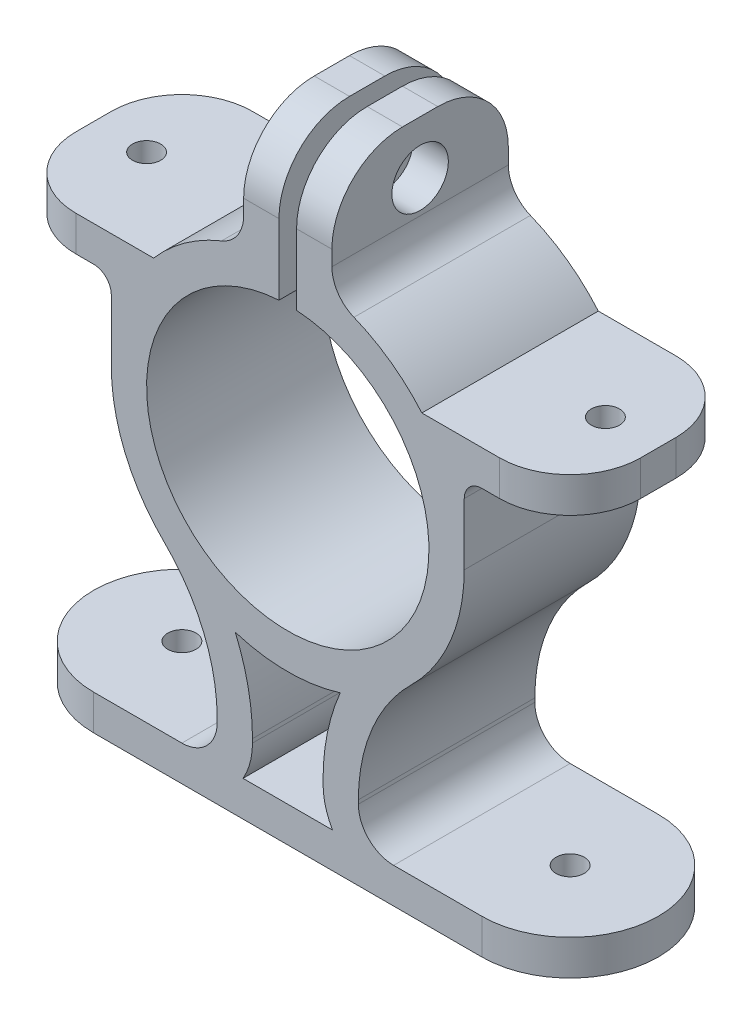
from build123d import *

# Parameters (mm, degrees)
BOSS_EXTRUDE1_DEPTH = 10
SKETCH3_R           = 0.8
CUT_EXTRUDE1_DEPTH  = 2
SKETCH4_R           = 0.8
CUT_EXTRUDE2_DEPTH  = 2
SKETCH5_R           = 0.8
CUT_EXTRUDE3_DEPTH  = 2
SKETCH6_R           = 0.8
CUT_EXTRUDE4_DEPTH  = 3
SKETCH7_R           = 1.6
CUT_EXTRUDE5_DEPTH  = 3
CUT_EXTRUDE6_DEPTH  = 10


with BuildPart() as part:
    # Sketch1 → Boss-Extrude1 (new body)
    with BuildSketch(Plane.XY):
        with BuildLine():
            Line((16.803004448, 0), (48.803096805, 0))
            Line((48.803096805, 0), (48.803096805, 2))
            Line((48.803096805, 2), (38.803096805, 2))
            ThreePointArc((38.803096805, 2), (37.388883243, 2.585786438), (36.803096805, 4))
            Line((36.803096805, 4), (36.803096805, 4.217123744))
            ThreePointArc((36.803096805, 4.217123744), (37.58355047, 8.090102619), (39.803089878, 11.358545383))
            ThreePointArc((39.803089878, 11.358545383), (42.022639537, 14.62700324), (42.803096805, 18.5))
            Line((42.803096805, 18.5), (42.803096805, 22))
            ThreePointArc((42.803096805, 22), (43.095990024, 22.707106781), (43.803096805, 23))
            Line((43.803096805, 23), (48.803096805, 23))
            Line((48.803096805, 23), (48.803096805, 25))
            Line((48.803096805, 25), (44.105786895, 25))
            Line((44.105786895, 25), (40.40245347, 25))
            ThreePointArc((40.40245347, 25), (38.644426823, 26.616603213), (36.553207437, 27.770234489))
            ThreePointArc((36.553207437, 27.770234489), (35.644914528, 28.506251313), (35.303235335, 29.624272825))
            Line((35.303235335, 29.624272825), (35.303235335, 34.487492178))
            Line((35.303235335, 34.487492178), (33.303050626, 34.487492178))
            Line((33.303050626, 34.487492178), (33.303050626, 26.484348185))
            ThreePointArc((33.303050626, 26.484348185), (32.803050626, 10.500011503), (32.303050626, 26.484348185))
            Line((32.303050626, 26.484348185), (32.303050626, 34.487492178))
            Line((32.303050626, 34.487492178), (30.303050626, 34.487492178))
            Line((30.303050626, 34.487492178), (30.303050626, 29.624347545))
            ThreePointArc((30.303050626, 29.624347545), (29.961362151, 28.506312265), (29.05304774, 27.770296755))
            ThreePointArc((29.05304774, 27.770296755), (26.961741815, 26.616651708), (25.203647783, 25))
            Line((25.203647783, 25), (21.500314358, 25))
            Line((21.500314358, 25), (16.803004448, 25))
            Line((16.803004448, 25), (16.803004448, 23))
            Line((16.803004448, 23), (21.803004448, 23))
            ThreePointArc((21.803004448, 23), (22.510111229, 22.707106781), (22.803004448, 22))
            Line((22.803004448, 22), (22.803004448, 18.5))
            ThreePointArc((22.803004448, 18.5), (23.583461716, 14.62700324), (25.803011375, 11.358545383))
            ThreePointArc((25.803011375, 11.358545383), (28.022550783, 8.090102619), (28.803004448, 4.217123744))
            Line((28.803004448, 4.217123744), (28.803004448, 4))
            ThreePointArc((28.803004448, 4), (28.21721801, 2.585786438), (26.803004448, 2))
            Line((26.803004448, 2), (16.803004448, 2))
            Line((16.803004448, 2), (16.803004448, 0))
        make_face()
        with BuildLine():
            Line((34.803096805, 4), (34.803096805, 4.217123744))
            ThreePointArc((34.803096805, 4.217123744), (35.049071096, 6.634328662), (35.776910074, 8.952438536))
            ThreePointArc((35.776910074, 8.952438536), (32.803050626, 8.500011503), (29.829191179, 8.952438536))
            ThreePointArc((29.829191179, 8.952438536), (30.557030157, 6.634328662), (30.803004448, 4.217123744))
            Line((30.803004448, 4.217123744), (30.803004448, 4))
            ThreePointArc((30.803004448, 4), (30.666707753, 2.96472382), (30.267106063, 2))
            Line((30.267106063, 2), (35.33899519, 2))
            ThreePointArc((35.33899519, 2), (34.9393935, 2.96472382), (34.803096805, 4))
        make_face(mode=Mode.SUBTRACT)
    extrude(amount=BOSS_EXTRUDE1_DEPTH)

    # Sketch3 → Cut-Extrude1 (cut)
    with BuildSketch(Plane(origin=(0, 2, 0), x_dir=(1, 0, 0), z_dir=(0, 1, 0))):
        with BuildLine():
            ThreePointArc((48.803096805, -5), (47.338630711, -8.535533906), (43.803096805, -10))
            Line((43.803096805, -10), (48.803096805, -10))
            Line((48.803096805, -10), (48.803096805, -5))
        make_face()
        with BuildLine():
            ThreePointArc((43.803096805, 0), (47.338630711, -1.464466094), (48.803096805, -5))
            Line((48.803096805, -5), (48.803096805, 0))
            Line((48.803096805, 0), (43.803096805, 0))
        make_face()
        with Locations((43.803096805, -5)):
            Circle(SKETCH3_R)
    extrude(amount=-CUT_EXTRUDE1_DEPTH, mode=Mode.SUBTRACT)

    # Sketch4 → Cut-Extrude2 (cut)
    with BuildSketch(Plane(origin=(0, 2, 0), x_dir=(1, 0, 0), z_dir=(0, 1, 0))):
        with BuildLine():
            Line((16.803004448, 0), (16.803004448, -5))
            ThreePointArc((16.803004448, -5), (18.267470542, -1.464466094), (21.803004448, 0))
            Line((21.803004448, 0), (16.803004448, 0))
        make_face()
        with BuildLine():
            Line((16.803004448, -10), (21.803004448, -10))
            ThreePointArc((21.803004448, -10), (18.267470542, -8.535533906), (16.803004448, -5))
            Line((16.803004448, -5), (16.803004448, -10))
        make_face()
        with Locations((21.803004448, -5)):
            Circle(SKETCH4_R)
    extrude(amount=-CUT_EXTRUDE2_DEPTH, mode=Mode.SUBTRACT)

    # Sketch5 → Cut-Extrude3 (cut)
    with BuildSketch(Plane(origin=(0, 25, 0), x_dir=(1, 0, 0), z_dir=(0, 1, 0))):
        with Locations((19.803004448, -5)):
            Circle(SKETCH5_R)
        with Locations((45.803096805, -5)):
            Circle(SKETCH5_R)
        with BuildLine():
            Line((20.803004448, -10), (16.803004448, -10))
            Line((16.803004448, -10), (16.803004448, -6))
            ThreePointArc((16.803004448, -6), (17.974577323, -8.828427125), (20.803004448, -10))
        make_face()
        with BuildLine():
            Line((16.803004448, -4), (16.803004448, 0))
            Line((16.803004448, 0), (20.803004448, 0))
            ThreePointArc((20.803004448, 0), (17.974577323, -1.171572875), (16.803004448, -4))
        make_face()
        with BuildLine():
            Line((44.803096805, 0), (48.803096805, 0))
            Line((48.803096805, 0), (48.803096805, -4))
            ThreePointArc((48.803096805, -4), (47.63152393, -1.171572875), (44.803096805, 0))
        make_face()
        with BuildLine():
            Line((48.803096805, -6), (48.803096805, -10))
            Line((48.803096805, -10), (44.803096805, -10))
            ThreePointArc((44.803096805, -10), (47.63152393, -8.828427125), (48.803096805, -6))
        make_face()
    extrude(amount=-CUT_EXTRUDE3_DEPTH, mode=Mode.SUBTRACT)

    # Sketch6 → Cut-Extrude4 (cut)
    with BuildSketch(Plane.ZY.offset(-30.303050626)):
        with Locations((5, 31.487492178)):
            Circle(SKETCH6_R)
    extrude(amount=-CUT_EXTRUDE4_DEPTH, mode=Mode.SUBTRACT)

    # Sketch7 → Cut-Extrude5 (cut)
    with BuildSketch(Plane(origin=(35.303235335, 0, 0), x_dir=(0, 0, -1), z_dir=(1, 0, 0))):
        with Locations((-5, 31.487492178)):
            Circle(SKETCH7_R)
    extrude(amount=-CUT_EXTRUDE5_DEPTH, mode=Mode.SUBTRACT)

    # Sketch8 → Cut-Extrude6 (cut)
    with BuildSketch(Plane.ZY.offset(-30.303050626)):
        with BuildLine():
            Line((0, 30.487492178), (0, 34.487492178))
            Line((0, 34.487492178), (4, 34.487492178))
            ThreePointArc((4, 34.487492178), (1.171572875, 33.315919302), (0, 30.487492178))
        make_face()
        with BuildLine():
            Line((6, 34.487492178), (10, 34.487492178))
            Line((10, 34.487492178), (10, 30.487492178))
            ThreePointArc((10, 30.487492178), (8.828427125, 33.315919302), (6, 34.487492178))
        make_face()
    extrude(amount=-CUT_EXTRUDE6_DEPTH, mode=Mode.SUBTRACT)


solid = part.part
